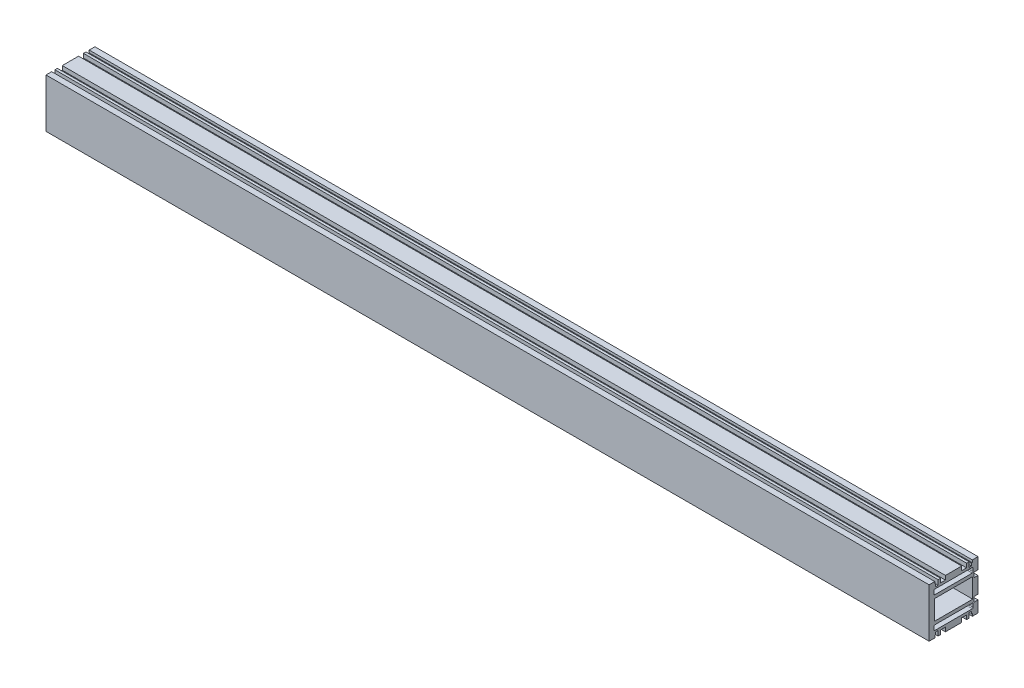
from build123d import *

# Parameters (mm, degrees)
SKETCH_1_W             = 23.5
SKETCH_1_H             = 12
EXTRUDE_1_DEPTH        = 271
HOLE_WIZARD_M6_1_D     = 5
HOLE_WIZARD_M6_1_DEPTH = 19
HOLE_WIZARD_M6_1_TIP   = 1.502151548
HOLE_WIZARD_M6_2_D     = 5
HOLE_WIZARD_M6_2_DEPTH = 19
HOLE_WIZARD_M6_2_TIP   = 1.502151548
HOLE_WIZARD_M4_1_D     = 3.3
HOLE_WIZARD_M4_1_DEPTH = 15
HOLE_WIZARD_M4_1_TIP   = 0.991420021


with BuildPart() as part:
    # 草图1 → 凸台-拉伸1 (new, symmetric)
    with BuildSketch(Plane(origin=(0, 0, 0), x_dir=(0, 0, -1), z_dir=(1, 0, 0))):
        Polygon((-15, 15), (-11.5, 15), (-11.5, 13.5), (-11, 13.5), (-11, 12), (-9.5, 12), (-9.5, 15), (-8, 15), (-8, 12.5), (-5, 12.5), (-5, 15), (5, 15), (5, 12.5), (8, 12.5), (8, 15), (9.5, 15), (9.5, 12), (11, 12), (11, 13.5), (11.5, 13.5), (11.5, 15), (15, 15), (15, 8), (12.5, 8), (12.5, 5), (15, 5), (15, -5), (12.5, -5), (12.5, -8), (15, -8), (15, -15), (11.5, -15), (11.5, -13.5), (11, -13.5), (11, -12), (9.5, -12), (9.5, -15), (8, -15), (8, -12.5), (5, -12.5), (5, -15), (-5, -15), (-5, -12.5), (-8, -12.5), (-8, -15), (-9.5, -15), (-9.5, -12), (-11, -12), (-11, -13.5), (-11.5, -13.5), (-11.5, -15), (-15, -15), align=None)
        with BuildLine():
            Line((12, -10.5), (12, -8.5))
            ThreePointArc((12, -8.5), (11.853553391, -8.146446609), (11.5, -8))
            Line((11.5, -8), (-11.5, -8))
            ThreePointArc((-11.5, -8), (-11.853553391, -8.146446609), (-12, -8.5))
            Line((-12, -8.5), (-12, -10.5))
            ThreePointArc((-12, -10.5), (-11.853553391, -10.853553391), (-11.5, -11))
            Line((-11.5, -11), (11.5, -11))
            ThreePointArc((11.5, -11), (11.853553391, -10.853553391), (12, -10.5))
        make_face(mode=Mode.SUBTRACT)
        with BuildLine():
            Line((-11.5, 11), (11.5, 11))
            ThreePointArc((11.5, 11), (11.853553391, 10.853553391), (12, 10.5))
            Line((12, 10.5), (12, 8.5))
            ThreePointArc((12, 8.5), (11.853553391, 8.146446609), (11.5, 8))
            Line((11.5, 8), (-11.5, 8))
            ThreePointArc((-11.5, 8), (-11.853553391, 8.146446609), (-12, 8.5))
            Line((-12, 8.5), (-12, 10.5))
            ThreePointArc((-12, 10.5), (-11.853553391, 10.853553391), (-11.5, 11))
        make_face(mode=Mode.SUBTRACT)
        Rectangle(SKETCH_1_W, SKETCH_1_H, mode=Mode.SUBTRACT)
    extrude(amount=EXTRUDE_1_DEPTH, both=True)

    # M6 螺纹孔1
    with Locations(Plane(origin=(0, -15, 0), x_dir=(-1, 0, 0), z_dir=(0, -1, 0))):
        with Locations((251, 0), (236, 0), (-236, 0), (-251, 0)):
            Hole(HOLE_WIZARD_M6_1_D / 2, depth=HOLE_WIZARD_M6_1_DEPTH)
            with Locations((0, 0, -(HOLE_WIZARD_M6_1_DEPTH + HOLE_WIZARD_M6_1_TIP / 2))):  # 118° drill point
                Cone(0, HOLE_WIZARD_M6_1_D / 2, HOLE_WIZARD_M6_1_TIP, mode=Mode.SUBTRACT)

    # M6 螺纹孔2
    with Locations(Plane(origin=(0, 0, -15), x_dir=(-1, 0, 0), z_dir=(0, 0, -1))):
        with Locations((-236, 0), (-251, 0)):
            Hole(HOLE_WIZARD_M6_2_D / 2, depth=HOLE_WIZARD_M6_2_DEPTH)
            with Locations((0, 0, -(HOLE_WIZARD_M6_2_DEPTH + HOLE_WIZARD_M6_2_TIP / 2))):  # 118° drill point
                Cone(0, HOLE_WIZARD_M6_2_D / 2, HOLE_WIZARD_M6_2_TIP, mode=Mode.SUBTRACT)

    # M4 螺纹孔1
    with Locations(Plane(origin=(0, 0, -15), x_dir=(-1, 0, 0), z_dir=(0, 0, -1))):
        with Locations((-201, 0), (21.5, 0), (60.5, 0), (258, 0)):
            Hole(HOLE_WIZARD_M4_1_D / 2, depth=HOLE_WIZARD_M4_1_DEPTH)
            with Locations((0, 0, -(HOLE_WIZARD_M4_1_DEPTH + HOLE_WIZARD_M4_1_TIP / 2))):  # 118° drill point
                Cone(0, HOLE_WIZARD_M4_1_D / 2, HOLE_WIZARD_M4_1_TIP, mode=Mode.SUBTRACT)


solid = part.part
